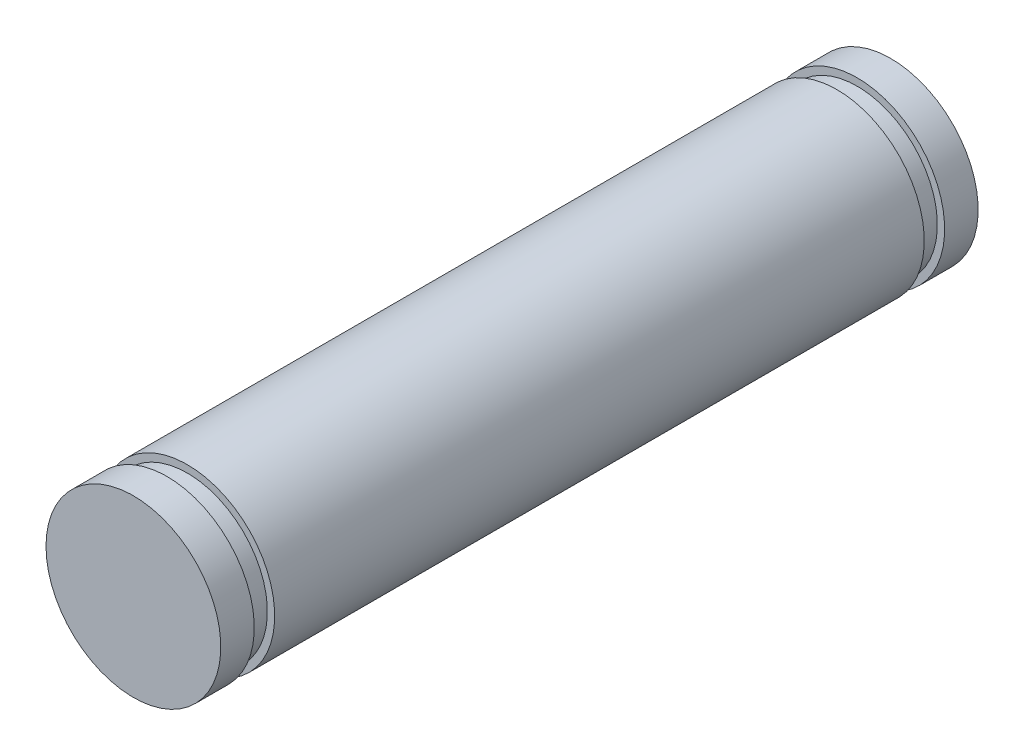
from build123d import *

# Parameters (mm, degrees)
SKETCH_1_R          = 3
EXTRUDE_1_DEPTH     = 26
SKETCH_2_R          = 3
SKETCH_2_R_2        = 2.75
CUT_EXTRUDE_1_DEPTH = 0.35


with BuildPart() as part:
    # 스케치1 → 보스-돌출1 (new body)
    with BuildSketch(Plane.XY):
        with Locations(Location((0, 0, 0), (0, 0, 180))):
            Circle(SKETCH_1_R)
    extrude(amount=EXTRUDE_1_DEPTH)

    # 스케치2 → 컷-돌출1 (cut, symmetric)
    with BuildSketch(Plane(origin=(0, 0, 1.5), x_dir=(-1, 0, 0), z_dir=(0, 0, -1))):
        Circle(SKETCH_2_R)
        Circle(SKETCH_2_R_2, mode=Mode.SUBTRACT)
    cut_extrude_1 = extrude(amount=CUT_EXTRUDE_1_DEPTH, both=True, mode=Mode.SUBTRACT)

    # 대칭 복사1: 컷-돌출1 across plane
    add(cut_extrude_1.mirror(Plane(origin=(0, 0, 13), x_dir=(1, 0, 0), z_dir=(0, 0, -1))), mode=Mode.SUBTRACT)


solid = part.part
